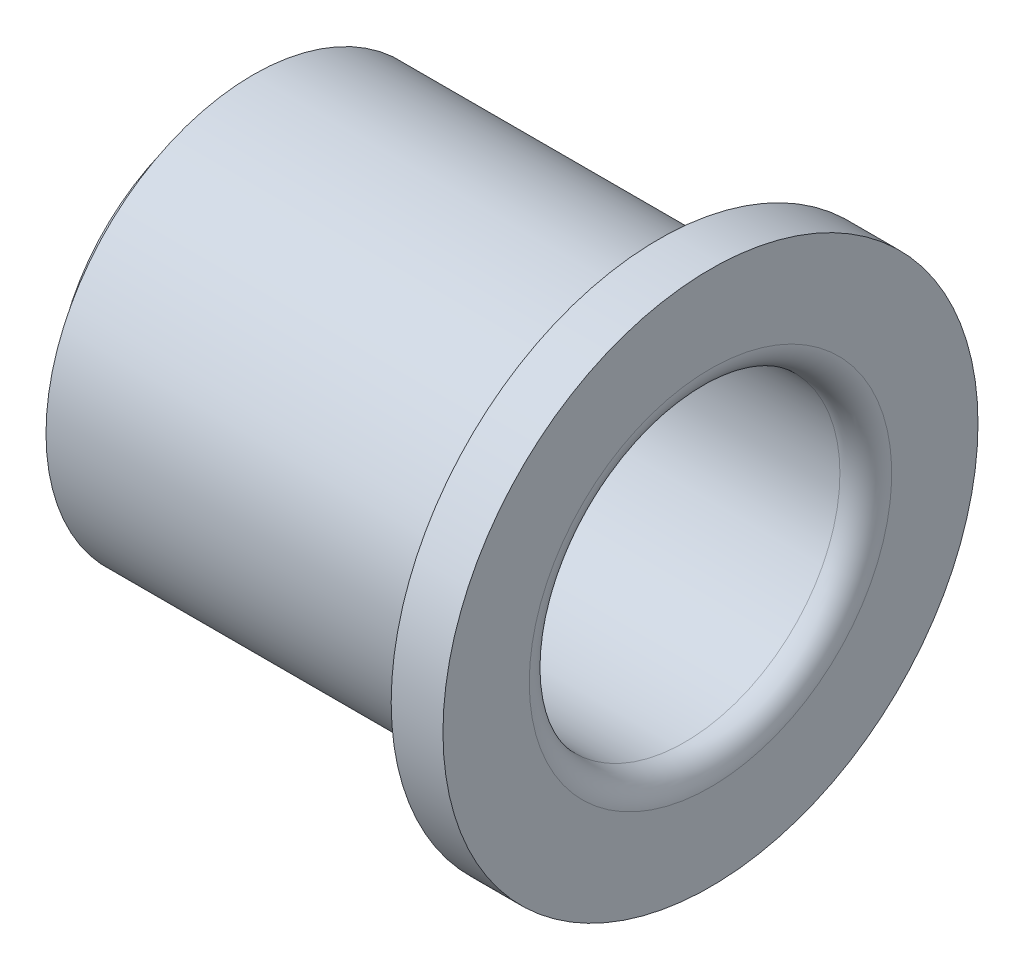
from build123d import *


with BuildPart() as part:
    # Esquisse1 → Base-Révolution (revolve)
    with BuildSketch(Plane.XY):
        with BuildLine():
            Line((-56, 18), (-3, 18))
            ThreePointArc((-3, 18), (-0.878679656, 18.878679656), (0, 21))
            Line((0, 21), (0, 31))
            Line((0, 31), (-6, 31))
            Line((-6, 31), (-6, 24))
            Line((-6, 24), (-53, 24))
            Line((-53, 24), (-53, 20))
            Line((-53, 20), (-56, 20))
            Line((-56, 20), (-56, 18))
        make_face()
    revolve(axis=Axis((-50.685125628, 0, 0), (1, 0, 0)))


solid = part.part
